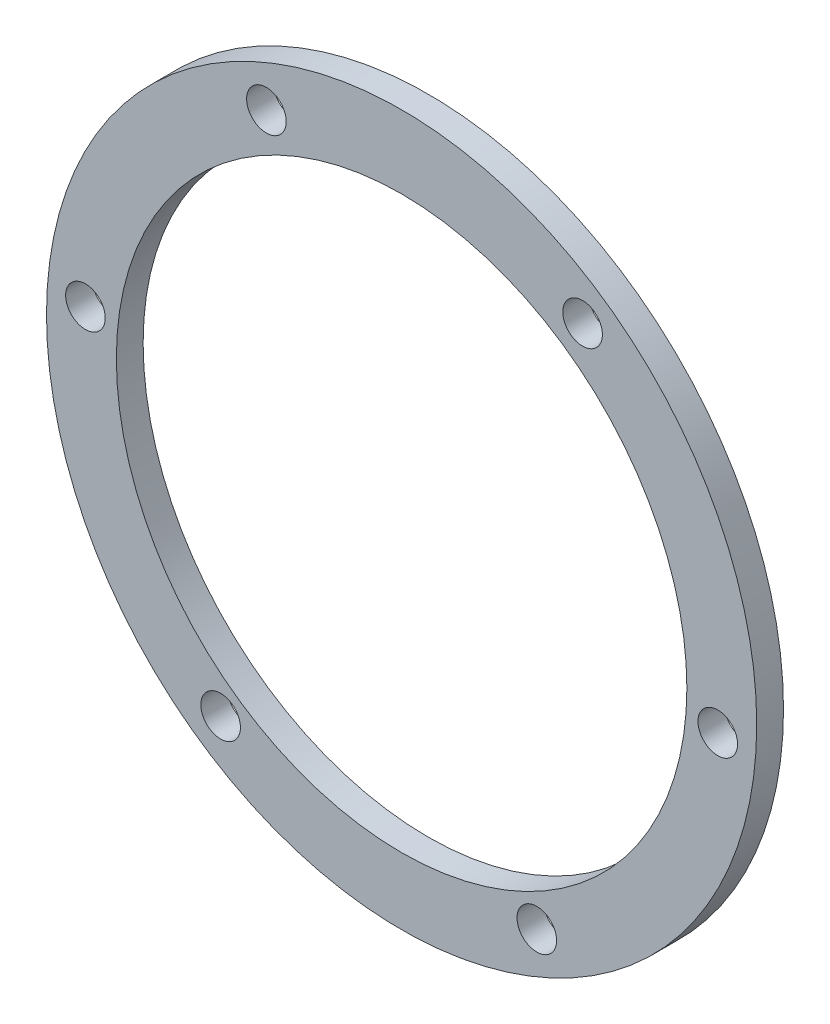
from build123d import *

# Parameters (mm, degrees)
ESQUISSE1_R                  = 30.5
ESQUISSE1_R_2                = 24.5
BOSS_EXTRU_1_DEPTH           = 2.3
ENL_V_MAT_EXTRU_2_REACH      = 45.379
ESQUISSE1_3_R                = 1.7
R_P_TITION_CIRCULAIRE1_COUNT = 6


with BuildPart() as part:
    # Esquisse1 → Boss.-Extru.1 (new body)
    with BuildSketch(Plane.XY):
        with Locations((0, -0.260069897)):
            Circle(ESQUISSE1_R)
        with Locations((0, -0.525514899)):
            Circle(ESQUISSE1_R_2, mode=Mode.SUBTRACT)
    extrude(amount=BOSS_EXTRU_1_DEPTH)

    # Esquisse1<3> → Enlèv. mat.-Extru.2 (cut, up to next)
    with BuildSketch(Plane.XY, mode=Mode.PRIVATE) as enl_v_mat_extru_2_sk1:
        with Locations((15.543281325, 22.122264781)):
            Circle(ESQUISSE1_3_R)
    enl_v_mat_extru_2_tool1 = extrude(enl_v_mat_extru_2_sk1.sketch, amount=ENL_V_MAT_EXTRU_2_REACH, mode=Mode.PRIVATE) & part.part
    enl_v_mat_extru_2 = enl_v_mat_extru_2_tool1.solids().sort_by_distance((15.543281, 22.122265, 0))[0]
    add(enl_v_mat_extru_2, mode=Mode.SUBTRACT)

    # Répétition circulaire1: Enlèv. mat.-Extru.2 ×6 about axis
    r_p_tition_circulaire1_axis = Axis((0, -0.260069897, 2.3), (0, 0, -1))
    for i in range(1, R_P_TITION_CIRCULAIRE1_COUNT):
        add(enl_v_mat_extru_2.rotate(r_p_tition_circulaire1_axis, i * 360 / R_P_TITION_CIRCULAIRE1_COUNT), mode=Mode.SUBTRACT)


solid = part.part
